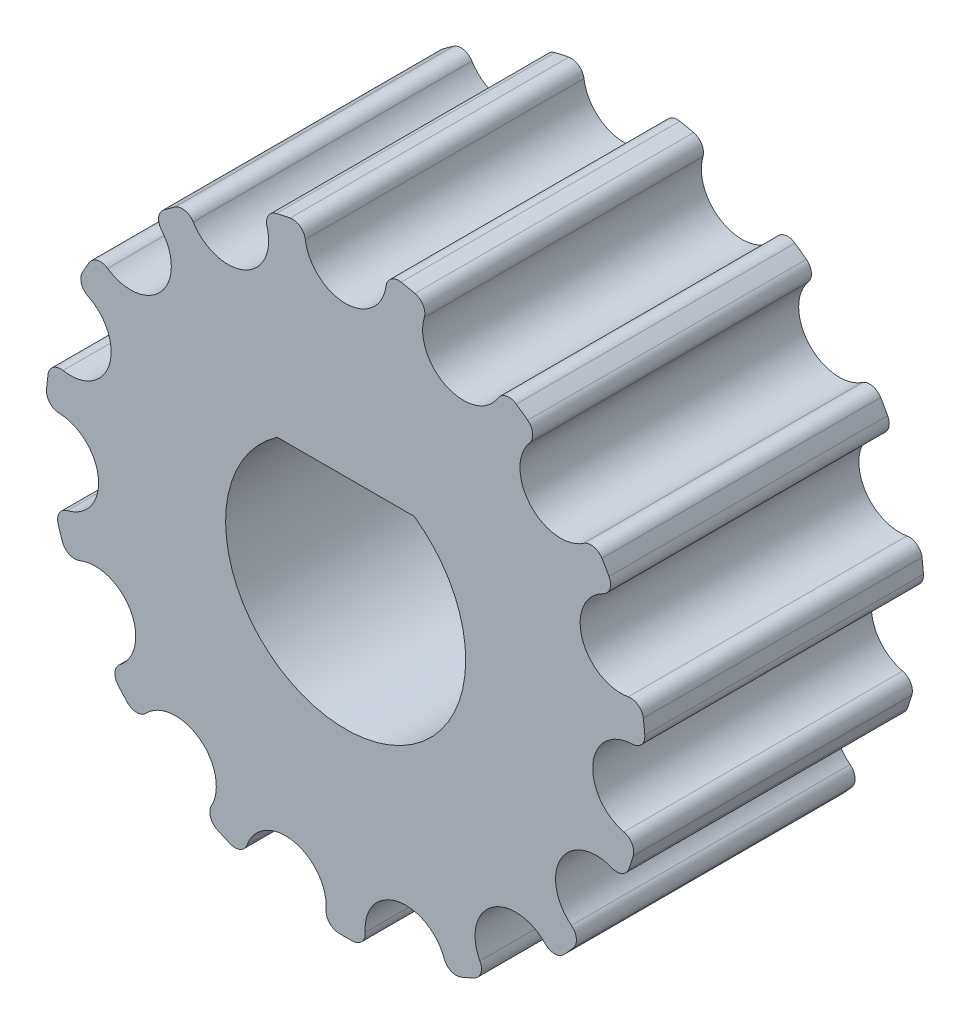
from build123d import *

# Parameters (mm, degrees)
SKIZZE1_R                            = 7
AUFSATZ_LINEAR_AUSTRAGEN1_DEPTH      = 3.25
SCHNITT_LINEAR_AUSTRAGEN1_DEPTH      = 11.419332992
VERRUNDUNG2_R                        = 0.3
KREISMUSTER1_COUNT                   = 15
VERRUNDUNG2_OF_KREISMUSTER1_R        = 0.3
SCHNITT_LINEAR_AUSTRAGEN2_DEPTH      = 11.404487693
SCHNITT_LINEAR_AUSTRAGEN2_DEPTH_BACK = 11.404487693


with BuildPart() as part:
    # Skizze1 → Aufsatz-Linear austragen1 (new, symmetric)
    with BuildSketch(Plane.XY):
        Circle(SKIZZE1_R)
    extrude(amount=AUFSATZ_LINEAR_AUSTRAGEN1_DEPTH, both=True)

    # Skizze2 → Schnitt-Linear austragen1 (cut, symmetric)
    with BuildSketch(Plane.XY):
        with BuildLine():
            Line((0.95, 6.75), (0.95, 7))
            Line((0.95, 7), (-0.95, 7))
            Line((-0.95, 7), (-0.95, 6.75))
            ThreePointArc((-0.95, 6.75), (0, 5.8), (0.95, 6.75))
        make_face()
    schnitt_linear_austragen1 = extrude(amount=SCHNITT_LINEAR_AUSTRAGEN1_DEPTH, both=True, mode=Mode.SUBTRACT)

    # Verrundung2
    verrundung2_edges = [part.edges().sort_by_distance(p)[0] for p in [
        (0.95, 6.935236117, 0),
        (-0.95, 6.935236117, 0),
    ]]
    fillet(verrundung2_edges, radius=VERRUNDUNG2_R)

    # Kreismuster1: Schnitt-Linear austragen1 ×15 about axis
    kreismuster1_axis = Axis((0, 0, 3.25), (0, 0, -1))
    for i in range(1, KREISMUSTER1_COUNT):
        add(schnitt_linear_austragen1.rotate(kreismuster1_axis, i * 360 / KREISMUSTER1_COUNT), mode=Mode.SUBTRACT)

    # Verrundung2 of Kreismuster1
    verrundung2_of_kreismuster1_edges = [part.edges().sort_by_distance(p)[0] for p in [
        (3.688682842, 5.949253642, 0),
        (1.952946472, 6.722053263, 0),
        (5.78955891, 3.934591164, 0),
        (4.518210758, 5.346566332, 0),
        (6.889367646, 1.23960213, 0),
        (6.302235357, 3.046609511, 0),
        (6.797942128, -1.669725374, 0),
        (6.996546208, 0.219866227, 0),
        (5.531090659, -4.290342192, 0),
        (6.481090659, -2.644893925, 0),
        (3.307863366, -6.169119868, 0),
        (4.844995655, -5.052327889, 0),
        (0.512676447, -6.981200675, 0),
        (2.371156888, -6.586168462, 0),
        (-2.371156888, -6.586168462, 0),
        (-0.512676447, -6.981200675, 0),
        (-4.844995655, -5.052327889, 0),
        (-3.307863366, -6.169119868, 0),
        (-6.481090659, -2.644893925, 0),
        (-5.531090659, -4.290342192, 0),
        (-6.996546208, 0.219866227, 0),
        (-6.797942128, -1.669725374, 0),
        (-6.302235357, 3.046609511, 0),
        (-6.889367646, 1.23960213, 0),
        (-4.518210758, 5.346566332, 0),
        (-5.78955891, 3.934591164, 0),
        (-1.952946472, 6.722053263, 0),
        (-3.688682842, 5.949253642, 0),
    ]]
    fillet(verrundung2_of_kreismuster1_edges, radius=VERRUNDUNG2_OF_KREISMUSTER1_R)

    # Skizze3 → Schnitt-Linear austragen2 (cut, two sides: drawn at the far end of the back side and taken through both)
    with BuildSketch(Plane.XY.offset(-SCHNITT_LINEAR_AUSTRAGEN2_DEPTH_BACK)):
        with BuildLine():
            Line((1.596871942, 2.3), (-1.596871942, 2.3))
            ThreePointArc((-1.596871942, 2.3), (0, -2.8), (1.596871942, 2.3))
        make_face()
    extrude(amount=SCHNITT_LINEAR_AUSTRAGEN2_DEPTH + SCHNITT_LINEAR_AUSTRAGEN2_DEPTH_BACK, mode=Mode.SUBTRACT)


solid = part.part
